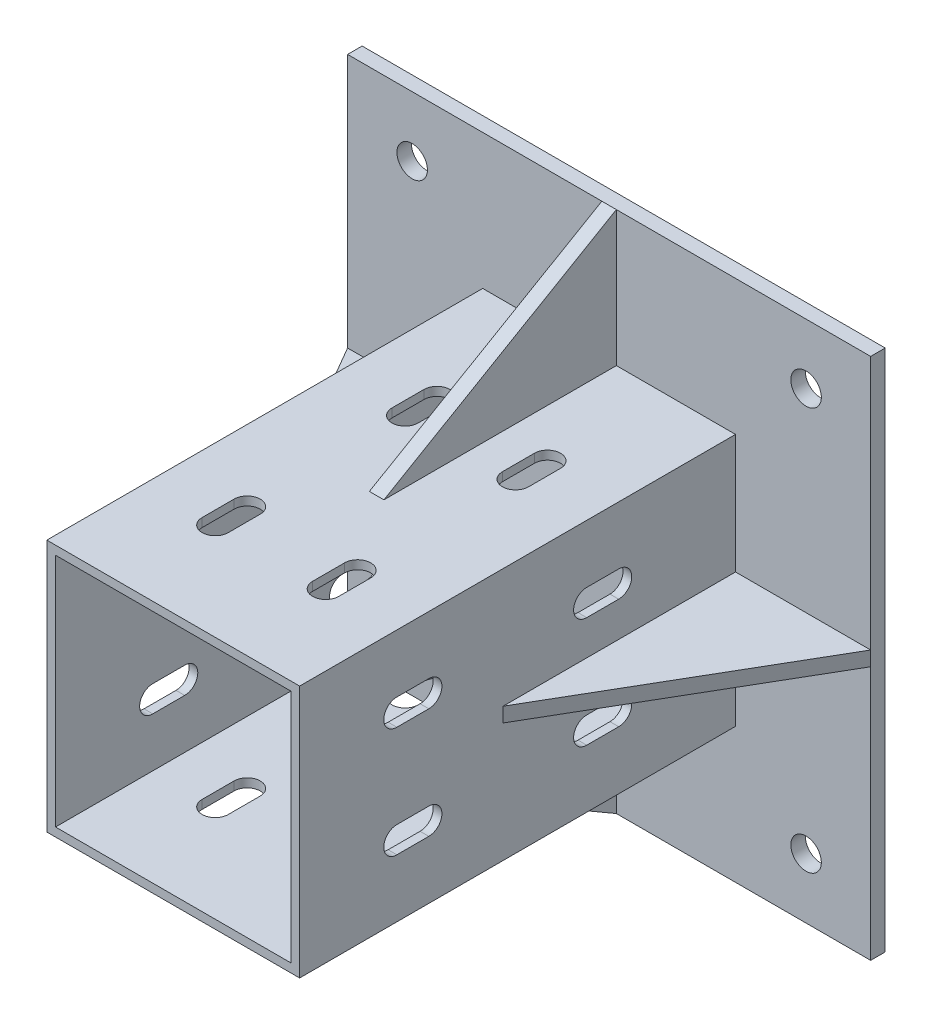
from build123d import *

# Parameters (mm, degrees)
SKETCH_1_W               = 180
SKETCH_1_H               = 180
EXTRUDE_1_DEPTH          = 5
SKETCH_2_R               = 5.25
CUT_EXTRUDE_1_DEPTH      = 128.377392029
MIRROR_2_COPY_1_SKETCH_R = 5.25
MIRROR_2_COPY_1_DEPTH    = 128.377392029
SKETCH_3_W               = 87
SKETCH_3_H               = 87
SKETCH_3_W_2             = 81
SKETCH_3_H_2             = 81
EXTRUDE_2_DEPTH          = 150
EXTRUDE_3_DEPTH          = 2.5
EXTRUDE_4_DEPTH          = 2.5
CUT_EXTRUDE_2_DEPTH      = 224.488814038
MIRROR_6_COPY_1_DEPTH    = 224.488814038


with BuildPart() as part:
    # 草图1 → 凸台-拉伸1 (new body)
    with BuildSketch(Plane.XY):
        Rectangle(SKETCH_1_W, SKETCH_1_H)
    extrude(amount=EXTRUDE_1_DEPTH)

    # 草图2 → 切除-拉伸1 (cut, through all)
    with BuildSketch(Plane.XY.offset(5)):
        with Locations((-67.776804162, 69.299878413)):
            Circle(SKETCH_2_R)
    cut_extrude_1 = extrude(amount=-CUT_EXTRUDE_1_DEPTH, mode=Mode.SUBTRACT)

    # 镜向1: 切除-拉伸1 across plane
    add(cut_extrude_1.mirror(Plane.ZX), mode=Mode.SUBTRACT)

    # 镜向2: 切除-拉伸1 across plane
    add(cut_extrude_1.mirror(Plane(origin=(0, 0, 0), x_dir=(0, 0, 1), z_dir=(1, 0, 0))), mode=Mode.SUBTRACT)

    # 镜向2 copy 1 sketch → 镜向2 copy 1 (cut, through all)
    with BuildSketch(Plane(origin=(0, 0, 5), x_dir=(-1, 0, 0), z_dir=(0, 0, 1))):
        with Locations((-67.776804162, 69.299878413)):
            Circle(MIRROR_2_COPY_1_SKETCH_R)
    extrude(amount=-MIRROR_2_COPY_1_DEPTH, mode=Mode.SUBTRACT)

    # 草图3 → 凸台-拉伸2 (add)
    with BuildSketch(Plane.XY.offset(5)):
        Rectangle(SKETCH_3_W, SKETCH_3_H)
        Rectangle(SKETCH_3_W_2, SKETCH_3_H_2, mode=Mode.SUBTRACT)
    extrude(amount=EXTRUDE_2_DEPTH)

    # 草图4 → 凸台-拉伸3 (add, symmetric)
    with BuildSketch(Plane(origin=(0, 0, 0), x_dir=(1, 0, 0), z_dir=(0, 1, 0))):
        Polygon((43.5, -5), (90, -5), (43.5, -85), align=None)
    extrude_3 = extrude(amount=EXTRUDE_3_DEPTH, both=True)

    # 镜向3: 凸台-拉伸3 across plane
    add(extrude_3.mirror(Plane(origin=(0, 0, 0), x_dir=(0, 0, 1), z_dir=(1, 0, 0))))

    # 草图5 → 凸台-拉伸4 (add, symmetric)
    with BuildSketch(Plane(origin=(0, 0, 0), x_dir=(0, 0, -1), z_dir=(1, 0, 0))):
        Polygon((-5, 43.5), (-5, 90), (-85, 43.5), align=None)
    extrude_4 = extrude(amount=EXTRUDE_4_DEPTH, both=True)

    # 镜向4: 凸台-拉伸4 across plane
    add(extrude_4.mirror(Plane.ZX))

    # 草图6 → 切除-拉伸2 (cut, through all)
    with BuildSketch(Plane.XZ.offset(43.5)):
        with BuildLine():
            Line((-14.50686738, 121.547822852), (-14.50686738, 110.547822852))
            ThreePointArc((-14.50686738, 110.547822852), (-19.00686738, 106.047822852), (-23.50686738, 110.547822852))
            Line((-23.50686738, 110.547822852), (-23.50686738, 121.547822852))
            ThreePointArc((-23.50686738, 121.547822852), (-19.00686738, 126.047822852), (-14.50686738, 121.547822852))
        make_face()
        with BuildLine():
            Line((-14.50686738, 56.214536174), (-14.50686738, 45.214536174))
            ThreePointArc((-14.50686738, 45.214536174), (-19.00686738, 40.714536174), (-23.50686738, 45.214536174))
            Line((-23.50686738, 45.214536174), (-23.50686738, 56.214536174))
            ThreePointArc((-23.50686738, 56.214536174), (-19.00686738, 60.714536174), (-14.50686738, 56.214536174))
        make_face()
    cut_extrude_2 = extrude(amount=-CUT_EXTRUDE_2_DEPTH, mode=Mode.SUBTRACT)

    # 镜向5: 切除-拉伸2 across plane
    add(cut_extrude_2.mirror(Plane(origin=(0, 0, 0), x_dir=(0, 0, 1), z_dir=(1, 0, 0))), mode=Mode.SUBTRACT)

    # 镜向6: 切除-拉伸2 across plane
    add(cut_extrude_2.mirror(Plane(origin=(0, 0, 0), x_dir=(0, 0, 1), z_dir=(0.7071067811865483, -0.7071067811865468, 0))), mode=Mode.SUBTRACT)

    # 镜向6 copy 1 sketch → 镜向6 copy 1 (cut, through all)
    with BuildSketch(Plane(origin=(-43.5, 0, 0), x_dir=(0, -1, 0), z_dir=(-1, 0, 0))):
        with BuildLine():
            Line((-14.50686738, 121.547822852), (-14.50686738, 110.547822852))
            ThreePointArc((-14.50686738, 110.547822852), (-19.00686738, 106.047822852), (-23.50686738, 110.547822852))
            Line((-23.50686738, 110.547822852), (-23.50686738, 121.547822852))
            ThreePointArc((-23.50686738, 121.547822852), (-19.00686738, 126.047822852), (-14.50686738, 121.547822852))
        make_face()
        with BuildLine():
            Line((-14.50686738, 56.214536174), (-14.50686738, 45.214536174))
            ThreePointArc((-14.50686738, 45.214536174), (-19.00686738, 40.714536174), (-23.50686738, 45.214536174))
            Line((-23.50686738, 45.214536174), (-23.50686738, 56.214536174))
            ThreePointArc((-23.50686738, 56.214536174), (-19.00686738, 60.714536174), (-14.50686738, 56.214536174))
        make_face()
    extrude(amount=-MIRROR_6_COPY_1_DEPTH, mode=Mode.SUBTRACT)


solid = part.part
